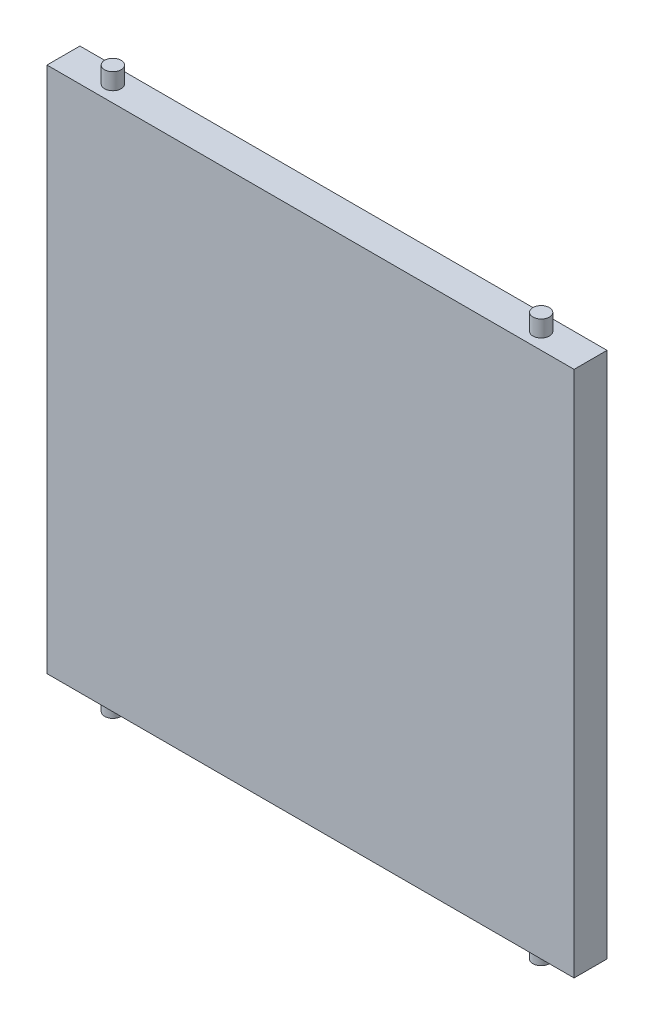
from build123d import *

# Parameters (mm, degrees)
SKETCH_2_W      = 160
SKETCH_2_H      = 160
EXTRUDE_1_DEPTH = 10
SKETCH_4_R      = 2.5
EXTRUDE_2_DEPTH = 85


with BuildPart() as part:
    # 草图2 → 凸台-拉伸1 (new body)
    with BuildSketch(Plane.XY):
        Rectangle(SKETCH_2_W, SKETCH_2_H)
    extrude(amount=EXTRUDE_1_DEPTH)

    # 草图4 → 凸台-拉伸2 (add, symmetric)
    with BuildSketch(Plane(origin=(0, 0, 0), x_dir=(1, 0, 0), z_dir=(0, 1, 0))):
        with Locations(Location((-65, -5, 0), (0, 0, 180))):
            Circle(SKETCH_4_R)
        with Locations(Location((65, -5, 0), (0, 0, 90))):
            Circle(SKETCH_4_R)
    extrude(amount=EXTRUDE_2_DEPTH, both=True)


solid = part.part
